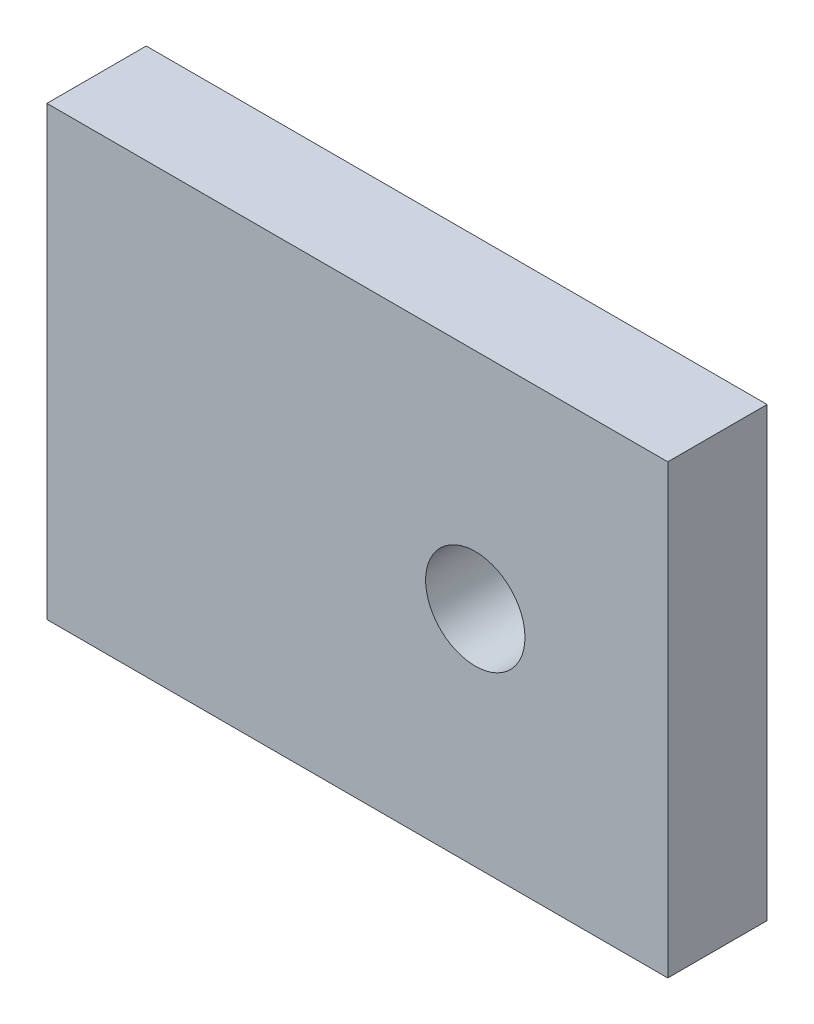
from build123d import *

# Parameters (mm, degrees)
SZKIC1_W                    = 25
SZKIC1_H                    = 18
DODANIE_WYCI_GNI_CIE1_DEPTH = 4
WYTNIJ_WYCI_GNI_CIE1_REACH  = 17.914
SZKIC2_R                    = 2


with BuildPart() as part:
    # Szkic1 → Dodanie-wyciągnięcie1 (new body)
    with BuildSketch(Plane.XY):
        Rectangle(SZKIC1_W, SZKIC1_H)
    extrude(amount=DODANIE_WYCI_GNI_CIE1_DEPTH)

    # Szkic2 → Wytnij-wyciągnięcie1 (cut, up to next)
    with BuildSketch(Plane.XY.offset(4), mode=Mode.PRIVATE) as wytnij_wyci_gni_cie1_sk1:
        with Locations((4.75, 0)):
            Circle(SZKIC2_R)
    wytnij_wyci_gni_cie1_tool1 = extrude(wytnij_wyci_gni_cie1_sk1.sketch, amount=-WYTNIJ_WYCI_GNI_CIE1_REACH, mode=Mode.PRIVATE) & part.part
    add(wytnij_wyci_gni_cie1_tool1.solids().sort_by_distance((4.75, 0, 4))[0], mode=Mode.SUBTRACT)


solid = part.part
